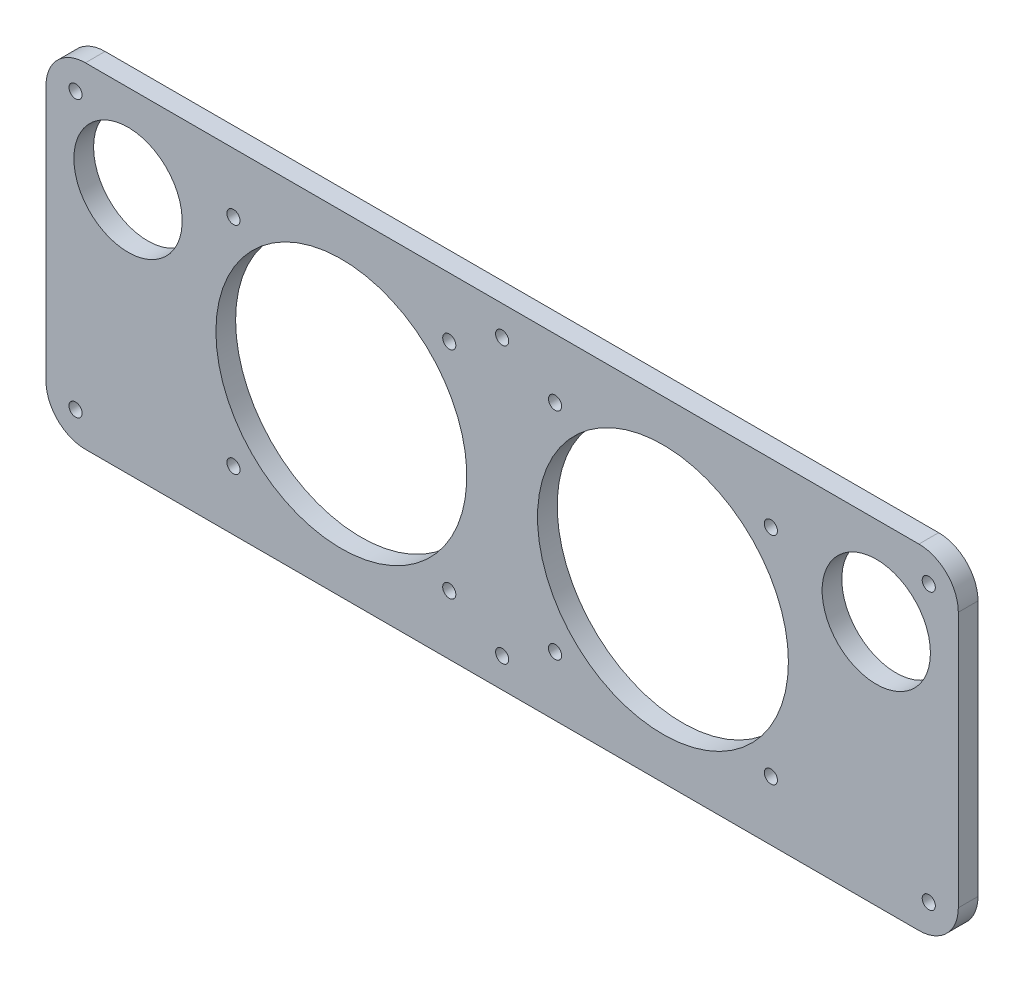
from build123d import *

# Parameters (mm, degrees)
SKETCH1_W                = 142
SKETCH1_H                = 102
BOSS_EXTRUDE1_DEPTH      = 6
SKETCH2_R                = 38.227
CUT_EXTRUDE1_DEPTH       = 149.182320133
SKETCH4_R                = 2
CUT_EXTRUDE2_DEPTH       = 149.182320133
CIRPATTERN1_COUNT        = 4
SKETCH5_R                = 16.5
CUT_EXTRUDE3_DEPTH       = 149.182320133
FILLET1_R                = 12
F_5_0_5_DIAMETER_HOLE1_D = 4


with BuildPart() as part:
    # Sketch1 → Boss-Extrude1 (new body)
    with BuildSketch(Plane.XY):
        with Locations((68, 0)):
            Rectangle(SKETCH1_W, SKETCH1_H)
    extrude(amount=-BOSS_EXTRUDE1_DEPTH)

    # Sketch2 → Cut-Extrude1 (cut, through all)
    with BuildSketch(Plane.XY):
        with Locations((49, 0)):
            Circle(SKETCH2_R)
    extrude(amount=-CUT_EXTRUDE1_DEPTH, mode=Mode.SUBTRACT)

    # Sketch4 → Cut-Extrude2 (cut, through all)
    with BuildSketch(Plane.XY):
        with Locations((81.880465325, 32.880465325)):
            Circle(SKETCH4_R)
    cut_extrude2 = extrude(amount=-CUT_EXTRUDE2_DEPTH, mode=Mode.SUBTRACT)

    # CirPattern1: Cut-Extrude2 ×4 about axis
    cirpattern1_axis = Axis((49, 0, 0), (0, 0, 1))
    for i in range(1, CIRPATTERN1_COUNT):
        add(cut_extrude2.rotate(cirpattern1_axis, i * 360 / CIRPATTERN1_COUNT), mode=Mode.SUBTRACT)

    # Sketch5 → Cut-Extrude3 (cut, through all)
    with BuildSketch(Plane.XY):
        with Locations((114, 24)):
            Circle(SKETCH5_R)
    extrude(amount=-CUT_EXTRUDE3_DEPTH, mode=Mode.SUBTRACT)

    # Mirror2: part across plane


with BuildPart() as part_1:
    add(part.part)
    add(part.part.mirror(Plane(origin=(0, 0, 0), x_dir=(0, 0, 1), z_dir=(1, 0, 0))))

    # Fillet1
    fillet1_edges = [part_1.edges().sort_by_distance(p)[0] for p in [
        (-139, 51, -3),
        (-139, -51, -3),
        (139, 51, -3),
        (139, -51, -3),
    ]]
    fillet(fillet1_edges, radius=FILLET1_R)

    # Ø5.0 (5) Diameter Hole1 (through all)
    with Locations(Plane.XY):
        with Locations((-130, 42), (130, -42), (-130, -42), (130, 42), (0, 42), (0, -42)):
            Hole(F_5_0_5_DIAMETER_HOLE1_D / 2)


solid = part_1.part
